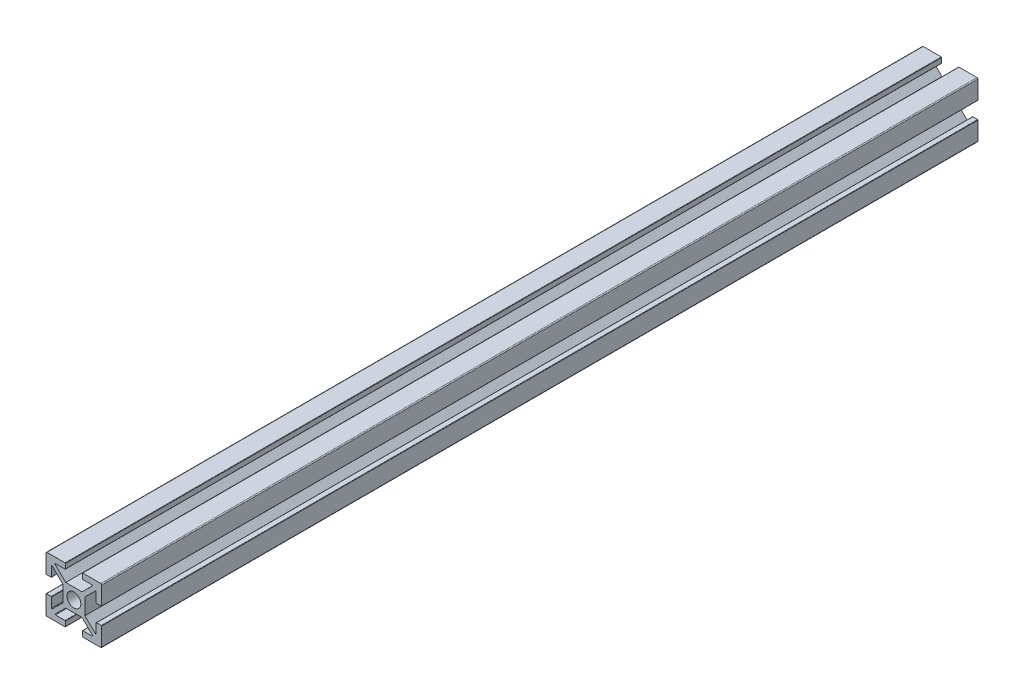
from build123d import *

# Parameters (mm, degrees)
SKETCH1_R           = 2.5
BOSS_EXTRUDE1_DEPTH = 315.81


with BuildPart() as part:
    # Sketch1 → Boss-Extrude1 (new body)
    with BuildSketch(Plane.XY):
        with BuildLine():
            Line((-31.376404226, -0.06181021), (-29.676404226, -0.06181021))
            ThreePointArc((-29.676404226, -0.06181021), (-29.570338208, -0.017876227), (-29.526404226, 0.08818979))
            Line((-29.526404226, 0.08818979), (-29.526404226, 3.524374304))
            ThreePointArc((-29.526404226, 3.524374304), (-29.43420518, 3.662790523), (-29.27095023, 3.631048831))
            Line((-29.27095023, 3.631048831), (-25.480107929, -0.116419988))
            Line((-25.480107929, -0.116419988), (-25.480107929, -6.007200432))
            Line((-25.480107929, -6.007200432), (-29.27095023, -9.754669251))
            ThreePointArc((-29.27095023, -9.754669251), (-29.43420518, -9.786410942), (-29.526404226, -9.647994723))
            Line((-29.526404226, -9.647994723), (-29.526404226, -6.21181021))
            ThreePointArc((-29.526404226, -6.21181021), (-29.570338208, -6.105744193), (-29.676404226, -6.06181021))
            Line((-29.676404226, -6.06181021), (-31.376404226, -6.06181021))
            ThreePointArc((-31.376404226, -6.06181021), (-31.482470243, -6.105744193), (-31.526404226, -6.21181021))
            Line((-31.526404226, -6.21181021), (-31.526404226, -12.71181021))
            ThreePointArc((-31.526404226, -12.71181021), (-31.423891599, -12.959297583), (-31.176404226, -13.06181021))
            Line((-31.176404226, -13.06181021), (-24.676404226, -13.06181021))
            ThreePointArc((-24.676404226, -13.06181021), (-24.570338208, -13.017876227), (-24.526404226, -12.91181021))
            Line((-24.526404226, -12.91181021), (-24.526404226, -11.21181021))
            ThreePointArc((-24.526404226, -11.21181021), (-24.570338208, -11.105744193), (-24.676404226, -11.06181021))
            Line((-24.676404226, -11.06181021), (-28.094489023, -11.06181021))
            ThreePointArc((-28.094489023, -11.06181021), (-28.233235517, -10.96881381), (-28.199943018, -10.805135682))
            Line((-28.199943018, -10.805135682), (-24.41329202, -7.06181021))
            Line((-24.41329202, -7.06181021), (-18.546923839, -7.06181021))
            Line((-18.546923839, -7.06181021), (-14.760272841, -10.805135682))
            ThreePointArc((-14.760272841, -10.805135682), (-14.726980342, -10.96881381), (-14.865726836, -11.06181021))
            Line((-14.865726836, -11.06181021), (-18.283811633, -11.06181021))
            ThreePointArc((-18.283811633, -11.06181021), (-18.38987765, -11.105744193), (-18.433811633, -11.21181021))
            Line((-18.433811633, -11.21181021), (-18.433811633, -12.91181021))
            ThreePointArc((-18.433811633, -12.91181021), (-18.38987765, -13.017876227), (-18.283811633, -13.06181021))
            Line((-18.283811633, -13.06181021), (-11.783811633, -13.06181021))
            ThreePointArc((-11.783811633, -13.06181021), (-11.53632426, -12.959297583), (-11.433811633, -12.71181021))
            Line((-11.433811633, -12.71181021), (-11.433811633, -6.21181021))
            ThreePointArc((-11.433811633, -6.21181021), (-11.477745616, -6.105744193), (-11.583811633, -6.06181021))
            Line((-11.583811633, -6.06181021), (-13.283811633, -6.06181021))
            ThreePointArc((-13.283811633, -6.06181021), (-13.38987765, -6.105744193), (-13.433811633, -6.21181021))
            Line((-13.433811633, -6.21181021), (-13.433811633, -9.647994723))
            ThreePointArc((-13.433811633, -9.647994723), (-13.526010678, -9.786410942), (-13.689265628, -9.754669251))
            Line((-13.689265628, -9.754669251), (-17.480107929, -6.007200432))
            Line((-17.480107929, -6.007200432), (-17.480107929, -0.116419988))
            Line((-17.480107929, -0.116419988), (-13.689265628, 3.631048831))
            ThreePointArc((-13.689265628, 3.631048831), (-13.526010678, 3.662790523), (-13.433811633, 3.524374304))
            Line((-13.433811633, 3.524374304), (-13.433811633, 0.08818979))
            ThreePointArc((-13.433811633, 0.08818979), (-13.38987765, -0.017876227), (-13.283811633, -0.06181021))
            Line((-13.283811633, -0.06181021), (-11.583811633, -0.06181021))
            ThreePointArc((-11.583811633, -0.06181021), (-11.477745616, -0.017876227), (-11.433811633, 0.08818979))
            Line((-11.433811633, 0.08818979), (-11.433811633, 6.58818979))
            ThreePointArc((-11.433811633, 6.58818979), (-11.53632426, 6.835677164), (-11.783811633, 6.93818979))
            Line((-11.783811633, 6.93818979), (-18.283811633, 6.93818979))
            ThreePointArc((-18.283811633, 6.93818979), (-18.38987765, 6.894255807), (-18.433811633, 6.78818979))
            Line((-18.433811633, 6.78818979), (-18.433811633, 5.08818979))
            ThreePointArc((-18.433811633, 5.08818979), (-18.38987765, 4.982123773), (-18.283811633, 4.93818979))
            Line((-18.283811633, 4.93818979), (-14.865726836, 4.93818979))
            ThreePointArc((-14.865726836, 4.93818979), (-14.726980342, 4.84519339), (-14.760272841, 4.681515262))
            Line((-14.760272841, 4.681515262), (-18.546923839, 0.93818979))
            Line((-18.546923839, 0.93818979), (-24.41329202, 0.93818979))
            Line((-24.41329202, 0.93818979), (-28.199943018, 4.681515262))
            ThreePointArc((-28.199943018, 4.681515262), (-28.233235517, 4.84519339), (-28.094489023, 4.93818979))
            Line((-28.094489023, 4.93818979), (-24.676404226, 4.93818979))
            ThreePointArc((-24.676404226, 4.93818979), (-24.570338208, 4.982123773), (-24.526404226, 5.08818979))
            Line((-24.526404226, 5.08818979), (-24.526404226, 6.78818979))
            ThreePointArc((-24.526404226, 6.78818979), (-24.570338208, 6.894255807), (-24.676404226, 6.93818979))
            Line((-24.676404226, 6.93818979), (-31.176404226, 6.93818979))
            ThreePointArc((-31.176404226, 6.93818979), (-31.423891599, 6.835677164), (-31.526404226, 6.58818979))
            Line((-31.526404226, 6.58818979), (-31.526404226, 0.08818979))
            ThreePointArc((-31.526404226, 0.08818979), (-31.482470243, -0.017876227), (-31.376404226, -0.06181021))
        make_face()
        with Locations(Location((-21.480107929, -3.06181021, 0), (0, 0, 180))):
            Circle(SKETCH1_R, mode=Mode.SUBTRACT)
    extrude(amount=BOSS_EXTRUDE1_DEPTH)


solid = part.part
